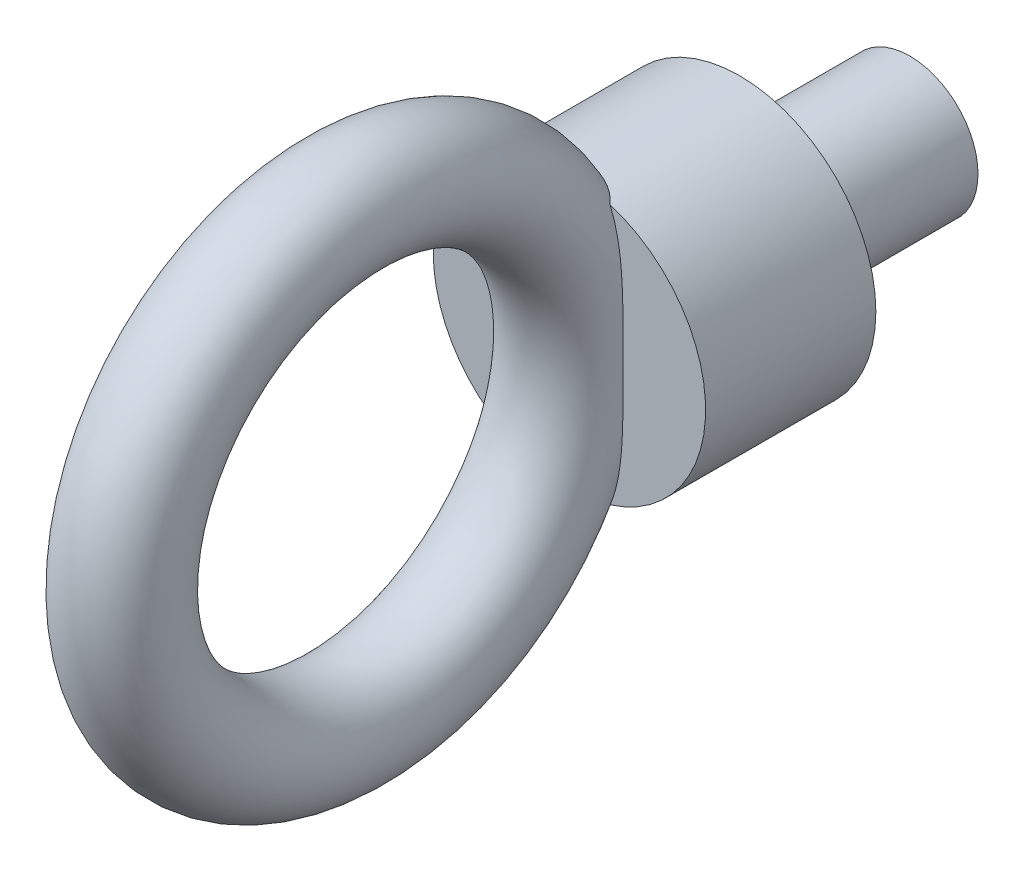
from build123d import *

# Parameters (mm, degrees)
SKETCH_1_R      = 4
EXTRUDE_1_DEPTH = 20
SKETCH_2_R      = 3.15
SKETCH_4_R      = 8
EXTRUDE_2_DEPTH = 5


with BuildPart() as part:
    # ｽｹｯﾁ1 → ﾎﾞｽ - 押し出し1 (new body)
    with BuildSketch(Plane.XY):
        Circle(SKETCH_1_R)
    extrude(amount=EXTRUDE_1_DEPTH)

    # ｽｲｰﾌﾟ1: sweep along a path in ｽｹｯﾁ3
    with BuildLine(Plane(origin=(0, 0, 0), x_dir=(0, 0, -1), z_dir=(1, 0, 0))) as sweep_1_path:
        CenterArc((-33.15, 0), 13.15, 0, 360)
    # ｽｹｯﾁ2 → ｽｲｰﾌﾟ1 (sweep)
    with BuildSketch(Plane(origin=(0, 0, 0), x_dir=(1, 0, 0), z_dir=(0, 1, 0))):
        with Locations((0, -20)):
            Circle(SKETCH_2_R)
    sweep(path=sweep_1_path.line)

    # ｽｹｯﾁ4 → ﾎﾞｽ - 押し出し2 (add, symmetric)
    with BuildSketch(Plane(origin=(0, 0, 15), x_dir=(-1, 0, 0), z_dir=(0, 0, -1))):
        Circle(SKETCH_4_R)
    extrude(amount=EXTRUDE_2_DEPTH, both=True)


solid = part.part
